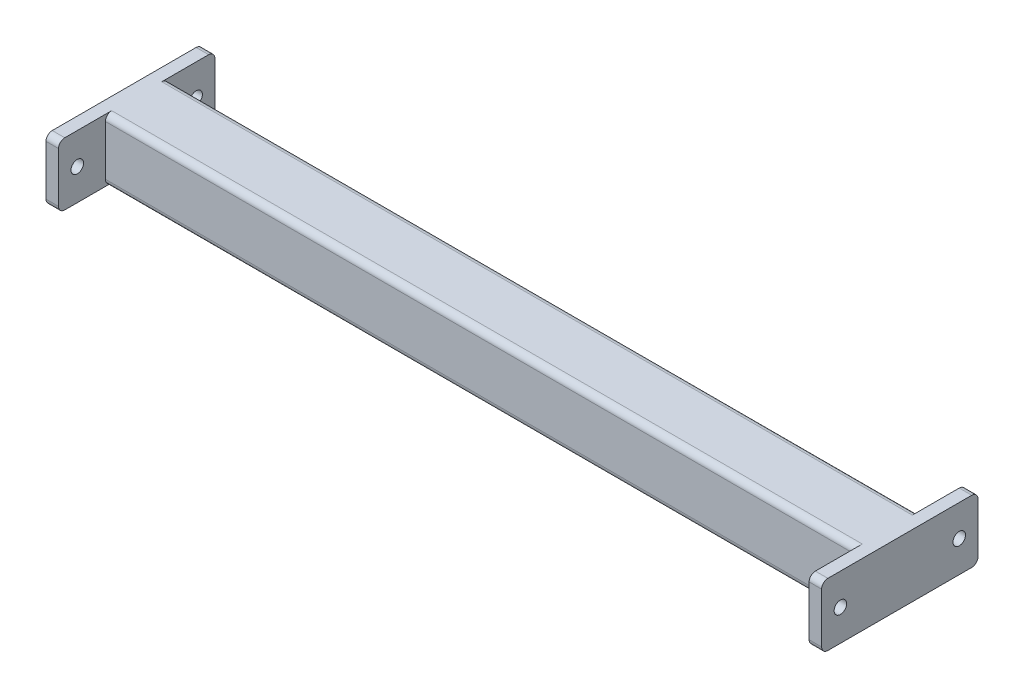
from build123d import *

# Parameters (mm, degrees)
BOSS_EXTRUDE1_DEPTH = 300
BOSS_EXTRUDE2_DEPTH = 10
SKETCH3_R           = 5
CUT_EXTRUDE1_DEPTH  = 624.643527987


with BuildPart() as part:
    # Sketch1 → Boss-Extrude1 (new, symmetric)
    with BuildSketch(Plane(origin=(0, 0, 0), x_dir=(0, 0, -1), z_dir=(1, 0, 0))):
        with BuildLine():
            Line((-20, 25), (20, 25))
            ThreePointArc((20, 25), (23.535533906, 23.535533906), (25, 20))
            Line((25, 20), (25, -20))
            ThreePointArc((25, -20), (23.535533906, -23.535533906), (20, -25))
            Line((20, -25), (-20, -25))
            ThreePointArc((-20, -25), (-23.535533906, -23.535533906), (-25, -20))
            Line((-25, -20), (-25, 20))
            ThreePointArc((-25, 20), (-23.535533906, 23.535533906), (-20, 25))
        make_face()
        with BuildLine():
            Line((-20, 23), (20, 23))
            ThreePointArc((20, 23), (22.121320344, 22.121320344), (23, 20))
            Line((23, 20), (23, -20))
            ThreePointArc((23, -20), (22.121320344, -22.121320344), (20, -23))
            Line((20, -23), (-20, -23))
            ThreePointArc((-20, -23), (-22.121320344, -22.121320344), (-23, -20))
            Line((-23, -20), (-23, 20))
            ThreePointArc((-23, 20), (-22.121320344, 22.121320344), (-20, 23))
        make_face(mode=Mode.SUBTRACT)
    extrude(amount=BOSS_EXTRUDE1_DEPTH, both=True)

    # Sketch2 → Boss-Extrude2 (add)
    with BuildSketch(Plane(origin=(300, 0, 0), x_dir=(0, 0, -1), z_dir=(1, 0, 0))):
        with BuildLine():
            Line((-57.5, 25), (57.5, 25))
            ThreePointArc((57.5, 25), (61.035533906, 23.535533906), (62.5, 20))
            Line((62.5, 20), (62.5, -20))
            ThreePointArc((62.5, -20), (61.035533906, -23.535533906), (57.5, -25))
            Line((57.5, -25), (-57.5, -25))
            ThreePointArc((-57.5, -25), (-61.035533906, -23.535533906), (-62.5, -20))
            Line((-62.5, -20), (-62.5, 20))
            ThreePointArc((-62.5, 20), (-61.035533906, 23.535533906), (-57.5, 25))
        make_face()
    boss_extrude2 = extrude(amount=BOSS_EXTRUDE2_DEPTH)

    # Mirror1: Boss-Extrude2 across plane
    add(boss_extrude2.mirror(Plane(origin=(0, 0, 0), x_dir=(0, 0, 1), z_dir=(1, 0, 0))))

    # Sketch3 → Cut-Extrude1 (cut, through all)
    with BuildSketch(Plane(origin=(310, 0, 0), x_dir=(0, 0, -1), z_dir=(1, 0, 0))):
        with Locations((-47.5, 0)):
            Circle(SKETCH3_R)
        with Locations((47.5, 0)):
            Circle(SKETCH3_R)
    extrude(amount=-CUT_EXTRUDE1_DEPTH, mode=Mode.SUBTRACT)


solid = part.part
